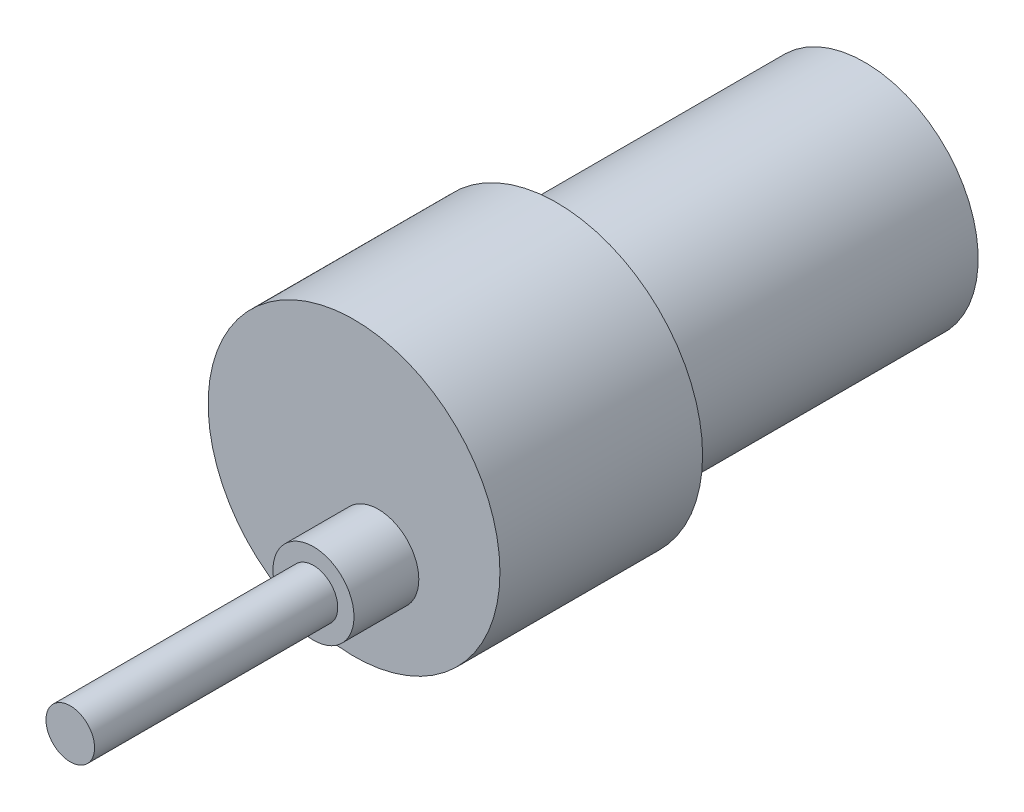
from build123d import *

# Parameters (mm, degrees)
SKETCH1_R           = 18
BOSS_EXTRUDE1_DEPTH = 25
SKETCH2_R           = 14
BOSS_EXTRUDE2_DEPTH = 38
SKETCH3_R           = 5
BOSS_EXTRUDE3_DEPTH = 2
SKETCH4_R           = 5
BOSS_EXTRUDE4_DEPTH = 8
SKETCH5_R           = 3
BOSS_EXTRUDE5_DEPTH = 30


with BuildPart() as part:
    # Sketch1 → Boss-Extrude1 (new body)
    with BuildSketch(Plane.XY):
        Circle(SKETCH1_R)
    extrude(amount=BOSS_EXTRUDE1_DEPTH)

    # Sketch2 → Boss-Extrude2 (add)
    with BuildSketch(Plane(origin=(0, 0, 0), x_dir=(-1, 0, 0), z_dir=(0, 0, -1))):
        Circle(SKETCH2_R)
    extrude(amount=BOSS_EXTRUDE2_DEPTH)

    # Sketch3 → Boss-Extrude3 (add)
    with BuildSketch(Plane(origin=(0, 0, -38), x_dir=(-1, 0, 0), z_dir=(0, 0, -1))):
        Circle(SKETCH3_R)
    extrude(amount=BOSS_EXTRUDE3_DEPTH)

    # Sketch4 → Boss-Extrude4 (add)
    with BuildSketch(Plane.XY.offset(25)):
        with Locations((2.991643327, -5.770621301)):
            Circle(SKETCH4_R)
    extrude(amount=BOSS_EXTRUDE4_DEPTH)

    # Sketch5 → Boss-Extrude5 (add)
    with BuildSketch(Plane.XY.offset(33)):
        with Locations((2.991643327, -5.770621301)):
            Circle(SKETCH5_R)
    extrude(amount=BOSS_EXTRUDE5_DEPTH)


solid = part.part
